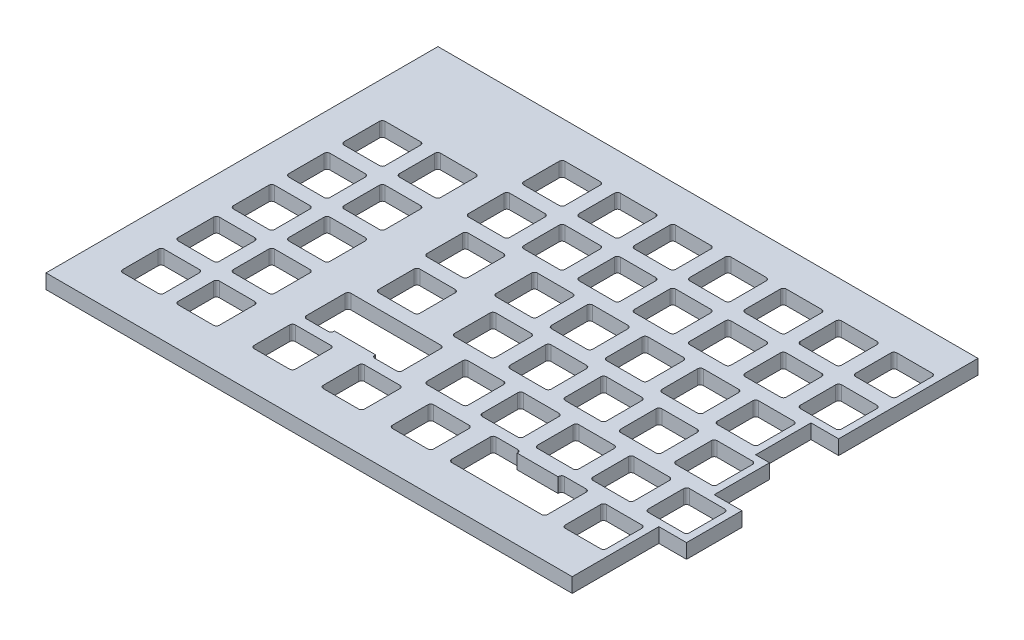
from build123d import *

# Parameters (mm, degrees)
PLATE_FRAME_DEPTH    = 5
CUT_EXTRUDE_1U_DEPTH = 234.752714222
CUT_EXTRUDE1_DEPTH   = 234.752714222
CUT_EXTRUDE2_DEPTH   = 234.752714222


with BuildPart() as part:
    # Sketch1 → Plate Frame (new body)
    with BuildSketch(Plane(origin=(0, 0, 0), x_dir=(1, 0, 0), z_dir=(0, 1, 0))):
        Polygon((0, 0), (0, 135), (186, 135), (186, 87), (176.475, 87), (176.475, 67.95), (181.2375, 67.95), (181.2375, 48.9), (190.7625, 48.9), (190.7625, 29.85), (181.2375, 29.85), (181.2375, 0), align=None)
    extrude(amount=PLATE_FRAME_DEPTH)

    # Sketch2 → Cut-Extrude 1U (cut, through all)
    with BuildSketch(Plane(origin=(0, 5, 0), x_dir=(1, 0, 0), z_dir=(0, 1, 0))):
        with BuildLine():
            Line((12.2125, 14.225), (12.2125, 26.425))
            ThreePointArc((12.2125, 26.425), (12.505393219, 27.132106781), (13.2125, 27.425))
            Line((13.2125, 27.425), (25.4125, 27.425))
            ThreePointArc((25.4125, 27.425), (26.119606781, 27.132106781), (26.4125, 26.425))
            Line((26.4125, 26.425), (26.4125, 14.225))
            ThreePointArc((26.4125, 14.225), (26.119606781, 13.517893219), (25.4125, 13.225))
            Line((25.4125, 13.225), (13.2125, 13.225))
            ThreePointArc((13.2125, 13.225), (12.505393219, 13.517893219), (12.2125, 14.225))
        make_face()
    cut_extrude_1u = extrude(amount=-CUT_EXTRUDE_1U_DEPTH, mode=Mode.SUBTRACT)

    # Sketch-Pattern1: Cut-Extrude 1U at 44 more places
    with Locations((19.05, 0, 0), (19.05, 0, -19.05), (0, 0, -19.05), (0, 0, -38.1), (19.05, 0, -38.1), (19.05, 0, -57.15), (0, 0, -57.15), (0, 0, -76.2), (19.05, 0, -76.2), (42.8625, 0, -95.25), (42.8625, 0, -76.2), (61.9125, 0, -76.2), (61.9125, 0, -95.25), (80.9625, 0, -95.25), (80.9625, 0, -76.2), (100.0125, 0, -76.2), (100.0125, 0, -95.25), (119.0625, 0, -95.25), (119.0625, 0, -76.2), (138.1125, 0, -76.2), (138.1125, 0, -95.25), (157.1625, 0, -95.25), (157.1625, 0, -76.2), (71.4375, 0, -57.15), (47.625, 0, -57.15), (90.4875, 0, -57.15), (109.5375, 0, -57.15), (128.5875, 0, -57.15), (147.6375, 0, -57.15), (76.2, 0, -38.1), (95.25, 0, -38.1), (114.3, 0, -38.1), (133.35, 0, -38.1), (152.4, 0, -38.1), (85.725, 0, -19.05), (104.775, 0, -19.05), (123.825, 0, -19.05), (142.875, 0, -19.05), (161.925, 0, -19.05), (69.05625, 0, 0), (92.86875, 0, 0), (50.00625, 0, -38.1), (152.4, 0, 0), (45.24375, 0, 0)):
        add(cut_extrude_1u, mode=Mode.SUBTRACT)

    # Sketch6 → Cut-Extrude1 (cut, through all)
    with BuildSketch(Plane(origin=(0, 5, 0), x_dir=(1, 0, 0), z_dir=(0, 1, 0))):
        with BuildLine():
            Line((57.58125, 32.125), (57.58125, 45.425))
            ThreePointArc((57.58125, 45.425), (57.874143219, 46.132106781), (58.58125, 46.425))
            Line((58.58125, 46.425), (89.58125, 46.425))
            ThreePointArc((89.58125, 46.425), (90.288356781, 46.132106781), (90.58125, 45.425))
            Line((90.58125, 45.425), (90.58125, 32.125))
            ThreePointArc((90.58125, 32.125), (90.288356781, 31.417893219), (89.58125, 31.125))
            Line((89.58125, 31.125), (82.13125, 31.125))
            ThreePointArc((82.13125, 31.125), (81.424143219, 31.417893219), (81.13125, 32.125))
            Line((81.13125, 32.125), (81.13125, 32.325))
            Line((81.13125, 32.325), (67.03125, 32.325))
            Line((67.03125, 32.325), (67.03125, 32.125))
            ThreePointArc((67.03125, 32.125), (66.738356781, 31.417893219), (66.03125, 31.125))
            Line((66.03125, 31.125), (58.58125, 31.125))
            ThreePointArc((58.58125, 31.125), (57.874143219, 31.417893219), (57.58125, 32.125))
        make_face()
    extrude(amount=-CUT_EXTRUDE1_DEPTH, mode=Mode.SUBTRACT)

    # Sketch7 → Cut-Extrude2 (cut, through all)
    with BuildSketch(Plane(origin=(0, 5, 0), x_dir=(1, 0, 0), z_dir=(0, 1, 0))):
        with BuildLine():
            Line((126.446875, 13.275), (157.446875, 13.275))
            ThreePointArc((157.446875, 13.275), (158.153981781, 13.567893219), (158.446875, 14.275))
            Line((158.446875, 14.275), (158.446875, 27.575))
            ThreePointArc((158.446875, 27.575), (158.153981781, 28.282106781), (157.446875, 28.575))
            Line((157.446875, 28.575), (149.996875, 28.575))
            ThreePointArc((149.996875, 28.575), (149.289768219, 28.282106781), (148.996875, 27.575))
            Line((148.996875, 27.575), (148.996875, 27.375))
            Line((148.996875, 27.375), (134.896875, 27.375))
            Line((134.896875, 27.375), (134.896875, 27.575))
            ThreePointArc((134.896875, 27.575), (134.603981781, 28.282106781), (133.896875, 28.575))
            Line((133.896875, 28.575), (126.446875, 28.575))
            ThreePointArc((126.446875, 28.575), (125.739768219, 28.282106781), (125.446875, 27.575))
            Line((125.446875, 27.575), (125.446875, 14.275))
            ThreePointArc((125.446875, 14.275), (125.739768219, 13.567893219), (126.446875, 13.275))
        make_face()
    extrude(amount=-CUT_EXTRUDE2_DEPTH, mode=Mode.SUBTRACT)


solid = part.part
